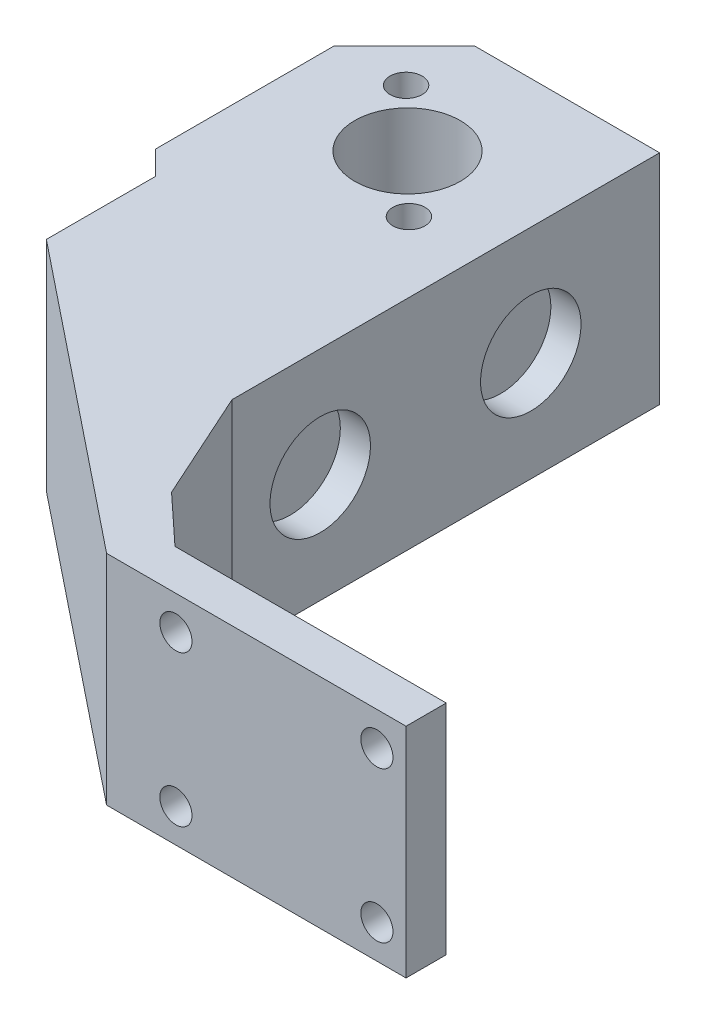
from build123d import *

# Parameters (mm, degrees)
SKICA1_W                 = 25.8
SKICA1_H                 = 21.7
SKICA1_R                 = 1.6
P_IDAT_VYSUNUT_M1_DEPTH  = 4
SKICA2_W                 = 4
SKICA2_H                 = 21.7
P_IDAT_VYSUNUT_M2_DEPTH  = 4
SKICA4_R                 = 5.25
SKICA4_R_2               = 1.6
P_IDAT_VYSUNUT_M3_DEPTH  = 21.7
ZKOSEN_1_SIZE            = 7
SKICA5_R                 = 5
ODEBRAT_VYSUNUT_M1_DEPTH = 3


with BuildPart() as part:
    # Skica1 → Přidat vysunutím1 (new body)
    with BuildSketch(Plane.XY):
        with Locations((3.311981452, -9.09140889)):
            Rectangle(SKICA1_W, SKICA1_H)
        with Locations((-6.688018548, -1.59140889)):
            Circle(SKICA1_R, mode=Mode.SUBTRACT)
        with Locations((13.311981452, -1.59140889)):
            Circle(SKICA1_R, mode=Mode.SUBTRACT)
        with Locations((13.311981452, -16.59140889)):
            Circle(SKICA1_R, mode=Mode.SUBTRACT)
        with Locations((-6.688018548, -16.59140889)):
            Circle(SKICA1_R, mode=Mode.SUBTRACT)
    extrude(amount=P_IDAT_VYSUNUT_M1_DEPTH)

    # Skica2 → Přidat vysunutím2 (add)
    with BuildSketch(Plane.ZY.offset(9.588018548)):
        with Locations((2, -9.09140889)):
            Rectangle(SKICA2_W, SKICA2_H)
    extrude(amount=P_IDAT_VYSUNUT_M2_DEPTH)

    # Skica4 → Přidat vysunutím3 (add)
    with BuildSketch(Plane(origin=(0, 1.75859111, 0), x_dir=(1, 0, 0), z_dir=(0, 1, 0))):
        Polygon((-13.588018548, -4), (-13.588018548, 0), (-10.783404097, 0), (-15.62281297, 4.500209586), (-20.589130875, 15.483860416), (-20.589130875, 33.262325999), (-20.589130875, 58.037674001), (-45.99437508, 58.037674001), (-45.99437508, 33.262325999), (-43.640152305, 30.908103223), (-43.640152305, 20.059780683), align=None)
        with Locations(Location((-33.291752977, 45.65, 0), (0, 0, 270))):
            Circle(SKICA4_R, mode=Mode.SUBTRACT)
        with Locations(Location((-39.019164168, 51.235406078, 0), (0, 0, 270))):
            Circle(SKICA4_R_2, mode=Mode.SUBTRACT)
        with Locations(Location((-27.564341787, 40.064593922, 0), (0, 0, 270))):
            Circle(SKICA4_R_2, mode=Mode.SUBTRACT)
    extrude(amount=-P_IDAT_VYSUNUT_M3_DEPTH)

    # Zkosení1
    zkosen_1_edges = [part.edges().sort_by_distance(p)[0] for p in [
        (-45.99437508, -9.09140889, -58.037674001),
    ]]
    chamfer(zkosen_1_edges, length=ZKOSEN_1_SIZE)

    # Skica5 → Odebrat vysunutím1 (cut)
    with BuildSketch(Plane(origin=(-20.589130875, 0, 0), x_dir=(0, 0, -1), z_dir=(1, 0, 0))):
        with Locations((24.263711451, -9.09140889)):
            Circle(SKICA5_R)
        with Locations((45.216218307, -9.09140889)):
            Circle(SKICA5_R)
    extrude(amount=-ODEBRAT_VYSUNUT_M1_DEPTH, mode=Mode.SUBTRACT)


solid = part.part
